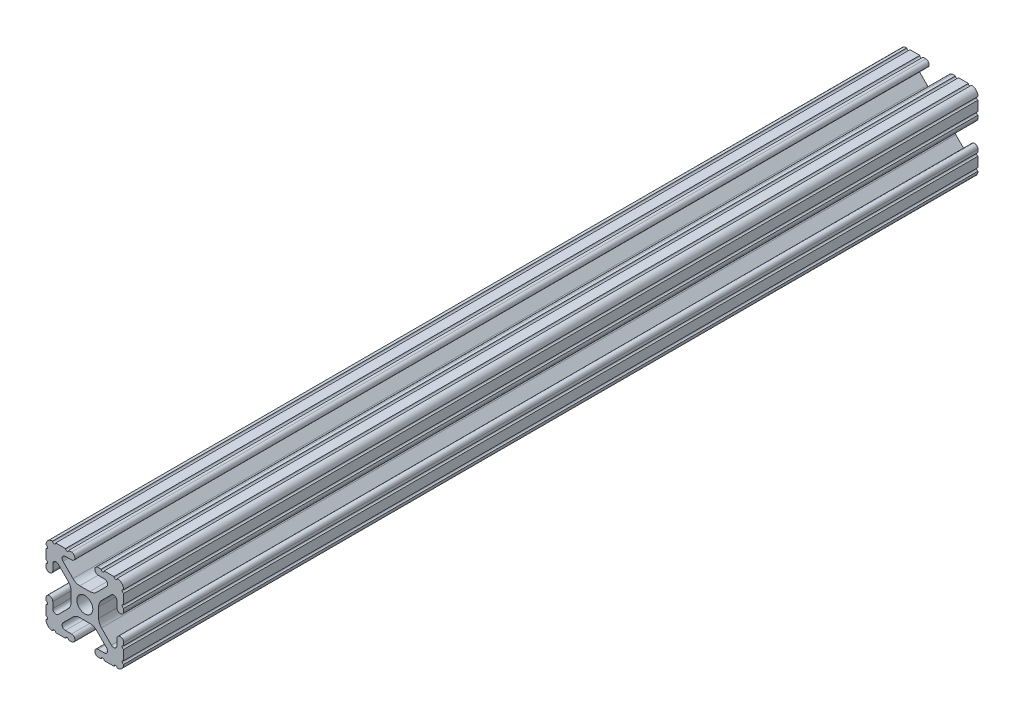
from build123d import *

# Parameters (mm, degrees)
SKETCH1_R           = 2.6035
BOSS_EXTRUDE1_DEPTH = 279.4


with BuildPart() as part:
    # Sketch1 → Boss-Extrude1 (new body)
    with BuildSketch(Plane.XY):
        with BuildLine():
            Line((10.5918, 12.7), (10.5664, 12.7))
            ThreePointArc((10.5664, 12.7), (10.0584, 12.192), (9.5504, 12.7))
            Line((9.5504, 12.7), (6.3246, 12.7))
            ThreePointArc((6.3246, 12.7), (5.8166, 12.192), (5.3086, 12.7))
            Line((5.3086, 12.7), (4.3561, 12.7))
            ThreePointArc((4.3561, 12.7), (3.2512, 11.5951), (4.3561, 10.4902))
            Line((4.3561, 10.4902), (6.370083786, 10.4902))
            ThreePointArc((6.370083786, 10.4902), (7.348856743, 9.836204819), (7.119204175, 8.681663397))
            Line((7.119204175, 8.681663397), (3.88464389, 5.447103113))
            ThreePointArc((3.88464389, 5.447103113), (2.854599758, 4.758849627), (1.63957986, 4.517167143))
            Line((1.63957986, 4.517167143), (-1.63957986, 4.517167143))
            ThreePointArc((-1.63957986, 4.517167143), (-2.854599758, 4.758849627), (-3.88464389, 5.447103113))
            Line((-3.88464389, 5.447103113), (-7.119204175, 8.681663397))
            ThreePointArc((-7.119204175, 8.681663397), (-7.348856743, 9.836204819), (-6.370083786, 10.4902))
            Line((-6.370083786, 10.4902), (-4.3561, 10.4902))
            ThreePointArc((-4.3561, 10.4902), (-3.2512, 11.5951), (-4.3561, 12.7))
            Line((-4.3561, 12.7), (-5.3086, 12.7))
            ThreePointArc((-5.3086, 12.7), (-5.8166, 12.192), (-6.3246, 12.7))
            Line((-6.3246, 12.7), (-9.5504, 12.7))
            ThreePointArc((-9.5504, 12.7), (-10.0584, 12.192), (-10.5664, 12.7))
            Line((-10.5664, 12.7), (-10.5918, 12.7))
            ThreePointArc((-10.5918, 12.7), (-12.082522516, 12.082522516), (-12.7, 10.5918))
            Line((-12.7, 10.5918), (-12.7, 10.5664))
            ThreePointArc((-12.7, 10.5664), (-12.192, 10.0584), (-12.7, 9.5504))
            Line((-12.7, 9.5504), (-12.7, 6.3246))
            ThreePointArc((-12.7, 6.3246), (-12.192, 5.8166), (-12.7, 5.3086))
            Line((-12.7, 5.3086), (-12.7, 4.3561))
            ThreePointArc((-12.7, 4.3561), (-11.5951, 3.2512), (-10.4902, 4.3561))
            Line((-10.4902, 4.3561), (-10.4902, 6.370083786))
            ThreePointArc((-10.4902, 6.370083786), (-9.836204819, 7.348856743), (-8.681663397, 7.119204175))
            Line((-8.681663397, 7.119204175), (-5.447103113, 3.88464389))
            ThreePointArc((-5.447103113, 3.88464389), (-4.758849627, 2.854599758), (-4.517167143, 1.63957986))
            Line((-4.517167143, 1.63957986), (-4.517167143, -1.63957986))
            ThreePointArc((-4.517167143, -1.63957986), (-4.758849627, -2.854599758), (-5.447103113, -3.88464389))
            Line((-5.447103113, -3.88464389), (-8.681663397, -7.119204175))
            ThreePointArc((-8.681663397, -7.119204175), (-9.836204819, -7.348856743), (-10.4902, -6.370083786))
            Line((-10.4902, -6.370083786), (-10.4902, -4.3561))
            ThreePointArc((-10.4902, -4.3561), (-11.5951, -3.2512), (-12.7, -4.3561))
            Line((-12.7, -4.3561), (-12.7, -5.3086))
            ThreePointArc((-12.7, -5.3086), (-12.192, -5.8166), (-12.7, -6.3246))
            Line((-12.7, -6.3246), (-12.7, -9.5504))
            ThreePointArc((-12.7, -9.5504), (-12.192, -10.0584), (-12.7, -10.5664))
            Line((-12.7, -10.5664), (-12.7, -10.5918))
            ThreePointArc((-12.7, -10.5918), (-12.082522516, -12.082522516), (-10.5918, -12.7))
            Line((-10.5918, -12.7), (-10.5664, -12.7))
            ThreePointArc((-10.5664, -12.7), (-10.0584, -12.192), (-9.5504, -12.7))
            Line((-9.5504, -12.7), (-6.3246, -12.7))
            ThreePointArc((-6.3246, -12.7), (-5.8166, -12.192), (-5.3086, -12.7))
            Line((-5.3086, -12.7), (-4.3561, -12.7))
            ThreePointArc((-4.3561, -12.7), (-3.2512, -11.5951), (-4.3561, -10.4902))
            Line((-4.3561, -10.4902), (-6.370083786, -10.4902))
            ThreePointArc((-6.370083786, -10.4902), (-7.348856743, -9.836204819), (-7.119204175, -8.681663397))
            Line((-7.119204175, -8.681663397), (-3.88464389, -5.447103113))
            ThreePointArc((-3.88464389, -5.447103113), (-2.854599758, -4.758849627), (-1.63957986, -4.517167143))
            Line((-1.63957986, -4.517167143), (1.63957986, -4.517167143))
            ThreePointArc((1.63957986, -4.517167143), (2.854599758, -4.758849627), (3.88464389, -5.447103113))
            Line((3.88464389, -5.447103113), (7.119204175, -8.681663397))
            ThreePointArc((7.119204175, -8.681663397), (7.348856743, -9.836204819), (6.370083786, -10.4902))
            Line((6.370083786, -10.4902), (4.3561, -10.4902))
            ThreePointArc((4.3561, -10.4902), (3.2512, -11.5951), (4.3561, -12.7))
            Line((4.3561, -12.7), (5.3086, -12.7))
            ThreePointArc((5.3086, -12.7), (5.8166, -12.192), (6.3246, -12.7))
            Line((6.3246, -12.7), (9.5504, -12.7))
            ThreePointArc((9.5504, -12.7), (10.0584, -12.192), (10.5664, -12.7))
            Line((10.5664, -12.7), (10.5918, -12.7))
            ThreePointArc((10.5918, -12.7), (12.082522516, -12.082522516), (12.7, -10.5918))
            Line((12.7, -10.5918), (12.7, -10.5664))
            ThreePointArc((12.7, -10.5664), (12.192, -10.0584), (12.7, -9.5504))
            Line((12.7, -9.5504), (12.7, -6.3246))
            ThreePointArc((12.7, -6.3246), (12.192, -5.8166), (12.7, -5.3086))
            Line((12.7, -5.3086), (12.7, -4.3561))
            ThreePointArc((12.7, -4.3561), (11.5951, -3.2512), (10.4902, -4.3561))
            Line((10.4902, -4.3561), (10.4902, -6.370083786))
            ThreePointArc((10.4902, -6.370083786), (9.836204819, -7.348856743), (8.681663397, -7.119204175))
            Line((8.681663397, -7.119204175), (5.447103113, -3.88464389))
            ThreePointArc((5.447103113, -3.88464389), (4.758849627, -2.854599758), (4.517167143, -1.63957986))
            Line((4.517167143, -1.63957986), (4.517167143, 1.63957986))
            ThreePointArc((4.517167143, 1.63957986), (4.758849627, 2.854599758), (5.447103113, 3.88464389))
            Line((5.447103113, 3.88464389), (8.681663397, 7.119204175))
            ThreePointArc((8.681663397, 7.119204175), (9.836204819, 7.348856743), (10.4902, 6.370083786))
            Line((10.4902, 6.370083786), (10.4902, 4.3561))
            ThreePointArc((10.4902, 4.3561), (11.5951, 3.2512), (12.7, 4.3561))
            Line((12.7, 4.3561), (12.7, 5.3086))
            ThreePointArc((12.7, 5.3086), (12.192, 5.8166), (12.7, 6.3246))
            Line((12.7, 6.3246), (12.7, 9.5504))
            ThreePointArc((12.7, 9.5504), (12.192, 10.0584), (12.7, 10.5664))
            Line((12.7, 10.5664), (12.7, 10.5918))
            ThreePointArc((12.7, 10.5918), (12.082522516, 12.082522516), (10.5918, 12.7))
        make_face()
        Circle(SKETCH1_R, mode=Mode.SUBTRACT)
    extrude(amount=BOSS_EXTRUDE1_DEPTH)


solid = part.part
